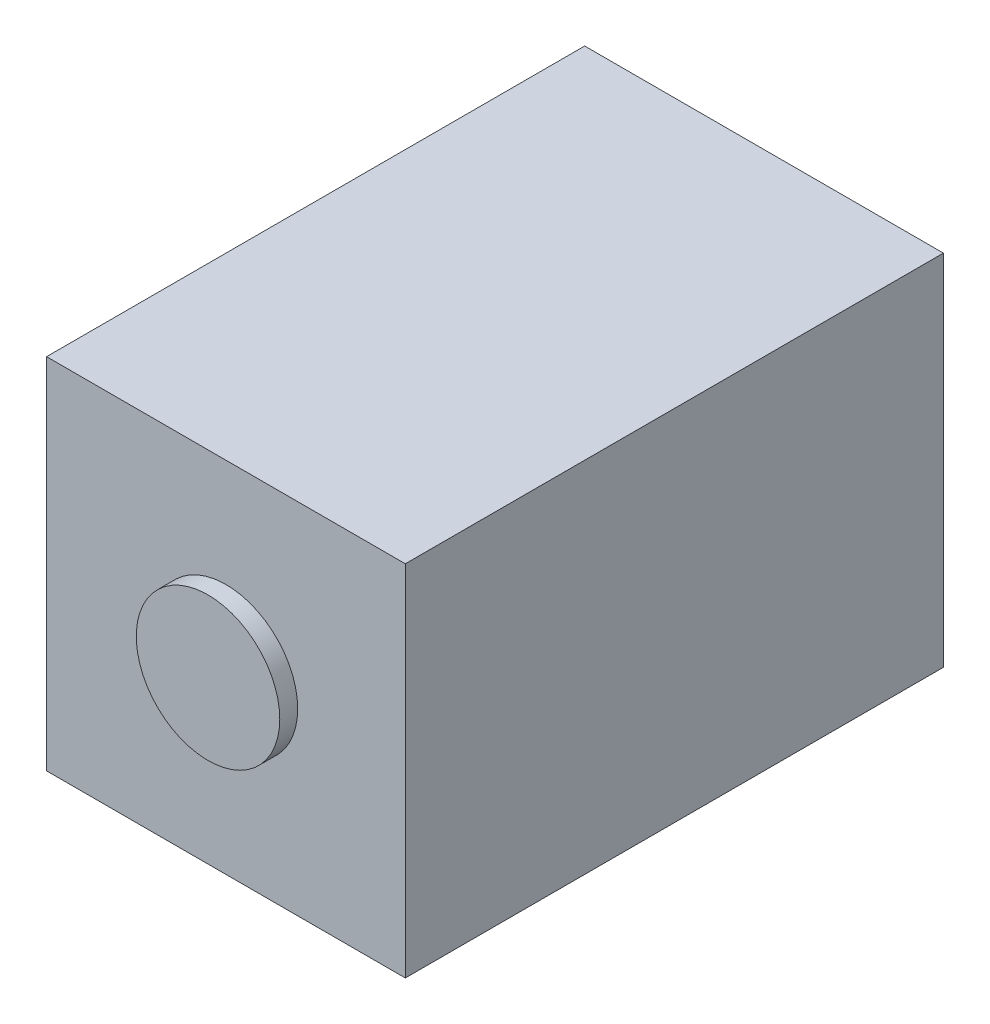
from build123d import *

# Parameters (mm, degrees)
SKETCH_1_W      = 200
SKETCH_1_H      = 200
EXTRUDE_1_DEPTH = 150
SKETCH_2_R      = 40
EXTRUDE_2_DEPTH = 10
EXTRUDE_START   = 10
SKETCH_3_R      = 40
EXTRUDE_3_DEPTH = 10


with BuildPart() as part:
    # 草图1 → 凸台-拉伸1 (new, symmetric)
    with BuildSketch(Plane.XY):
        Rectangle(SKETCH_1_W, SKETCH_1_H)
    extrude(amount=EXTRUDE_1_DEPTH, both=True)

    # 草图2 → 凸台-拉伸2 (add)
    with BuildSketch(Plane.XY.offset(150)):
        Circle(SKETCH_2_R)
    extrude(amount=EXTRUDE_2_DEPTH)

    # 草图3 → 凸台-拉伸3 (add)
    with BuildSketch(Plane(origin=(0, 0, -150), x_dir=(-1, 0, 0), z_dir=(0, 0, -1)).offset(EXTRUDE_START)):
        with Locations(Location((0, 0, 0), (0, 0, 180))):
            Circle(SKETCH_3_R)
    extrude(amount=-EXTRUDE_3_DEPTH)


solid = part.part
